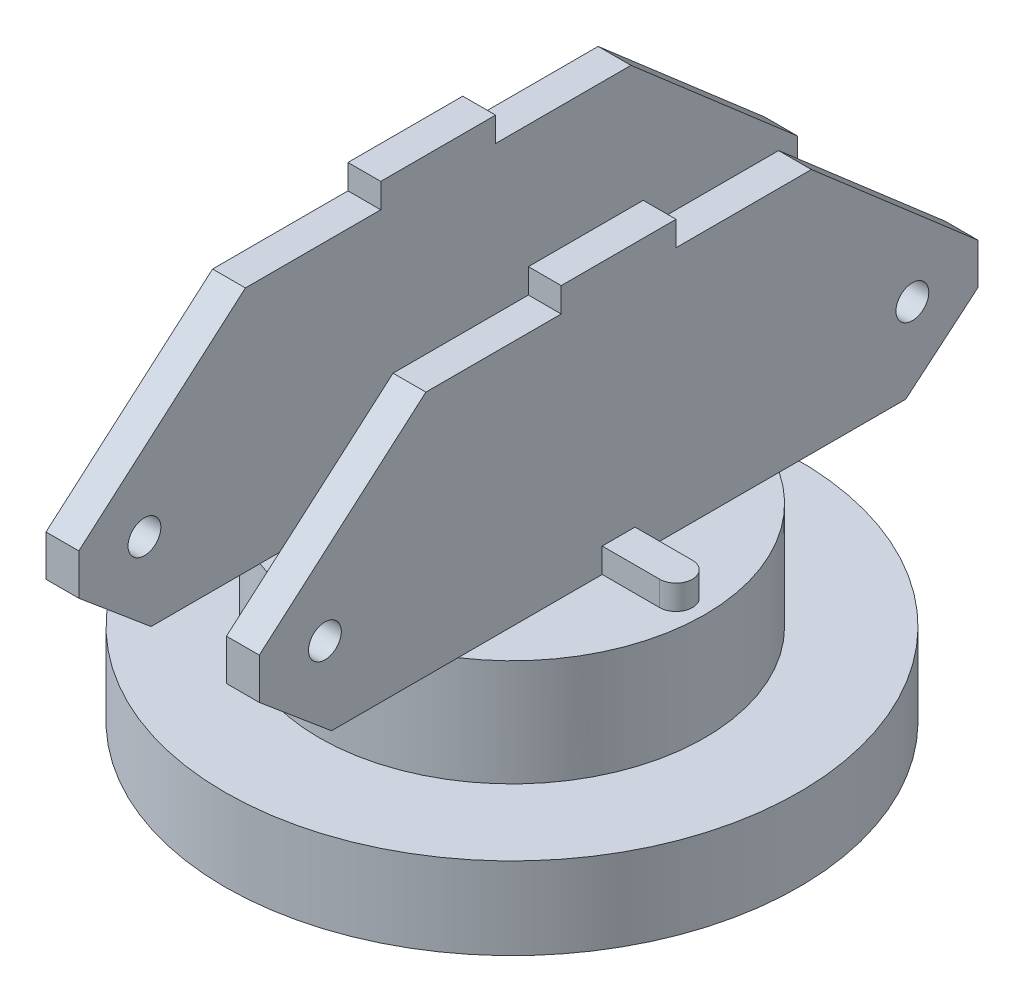
from build123d import *

# Parameters (mm, degrees)
SKETCH1_R           = 17.5
BOSS_EXTRUDE1_DEPTH = 5
SKETCH2_R           = 11.75
BOSS_EXTRUDE2_DEPTH = 6.5
BOSS_EXTRUDE4_DEPTH = 1.5
SKETCH4_R           = 1
BOSS_EXTRUDE5_DEPTH = 2
SKETCH5_R           = 5
CUT_EXTRUDE1_DEPTH  = 5


with BuildPart() as part:
    # Sketch1 → Boss-Extrude1 (new body)
    with BuildSketch(Plane(origin=(0, 0, 0), x_dir=(1, 0, 0), z_dir=(0, 1, 0))):
        with Locations(Location((0, 0, 0), (0, 0, 270))):
            Circle(SKETCH1_R)
    extrude(amount=BOSS_EXTRUDE1_DEPTH)

    # Sketch2 → Boss-Extrude2 (add)
    with BuildSketch(Plane(origin=(0, 5, 0), x_dir=(1, 0, 0), z_dir=(0, 1, 0))):
        with Locations(Location((0, 0, 0), (0, 0, 90))):
            Circle(SKETCH2_R)
    extrude(amount=BOSS_EXTRUDE2_DEPTH)

    # Sketch3 → Boss-Extrude4 (add)
    with BuildSketch(Plane(origin=(0, 11.5, 0), x_dir=(1, 0, 0), z_dir=(0, 1, 0))):
        with BuildLine():
            Line((-6.5, 0), (-6.5, 1))
            Line((-6.5, 1), (-10, 1))
            ThreePointArc((-10, 1), (-11, 0), (-10, -1))
            Line((-10, -1), (-6.5, -1))
            Line((-6.5, -1), (-6.5, 0))
        make_face()
        with BuildLine():
            Line((6.5, -1), (6.5, 0))
            Line((6.5, 0), (6.5, 1))
            Line((6.5, 1), (10, 1))
            ThreePointArc((10, 1), (11, 0), (10, -1))
            Line((10, -1), (6.5, -1))
        make_face()
    extrude(amount=BOSS_EXTRUDE4_DEPTH)

    # Sketch4 → Boss-Extrude5 (add)
    with BuildSketch(Plane(origin=(-6.5, 0, 0), x_dir=(0, 0, -1), z_dir=(1, 0, 0))):
        Polygon((-17.5, 11.5), (17.5, 11.5), (21.904755548, 15.196028756), (21.904755548, 17.696028756), (11.75, 26.5), (3.5, 26.5), (3.5, 28), (-3.5, 28), (-3.5, 26.5), (-11.75, 26.5), (-21.904755548, 17.696028756), (-21.904755548, 15.196028756), align=None)
        with Locations((17.904755548, 16.446028756)):
            Circle(SKETCH4_R, mode=Mode.SUBTRACT)
        with Locations(Location((-17.904755548, 16.446028756, 0), (0, 0, 180))):
            Circle(SKETCH4_R, mode=Mode.SUBTRACT)
    boss_extrude5 = extrude(amount=BOSS_EXTRUDE5_DEPTH)

    # Mirror1: Boss-Extrude5 across plane
    add(boss_extrude5.mirror(Plane(origin=(0, 0, 0), x_dir=(0, 0, 1), z_dir=(1, 0, 0))))

    # Sketch5 → Cut-Extrude1 (cut)
    with BuildSketch(Plane.XZ):
        with Locations(Location((0, 0, 0), (0, 0, 270))):
            Circle(SKETCH5_R)
    extrude(amount=-CUT_EXTRUDE1_DEPTH, mode=Mode.SUBTRACT)


solid = part.part
